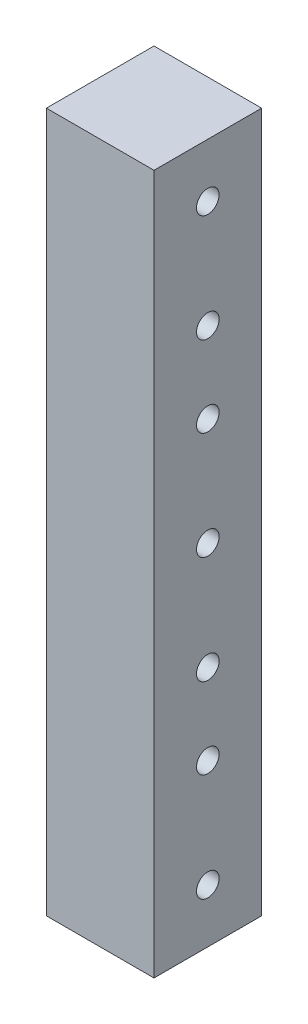
from build123d import *

# Parameters (mm, degrees)
SKETCH_1_W          = 20
SKETCH_1_H          = 20
EXTRUDE_1_DEPTH     = 130
SKETCH_2_R          = 2.1
CUT_EXTRUDE_1_DEPTH = 132.909059583


with BuildPart() as part:
    # 草图1 → 凸台-拉伸1 (new body)
    with BuildSketch(Plane(origin=(0, 0, 0), x_dir=(1, 0, 0), z_dir=(0, 1, 0))):
        Rectangle(SKETCH_1_W, SKETCH_1_H)
    extrude(amount=EXTRUDE_1_DEPTH)

    # 草图2 → 切除-拉伸1 (cut, through all)
    with BuildSketch(Plane(origin=(10, 0, 0), x_dir=(0, 0, -1), z_dir=(1, 0, 0))):
        with Locations((0, 45)):
            Circle(SKETCH_2_R)
        with Locations((0, 65)):
            Circle(SKETCH_2_R)
        with Locations((0, 85)):
            Circle(SKETCH_2_R)
        with Locations((0, 10)):
            Circle(SKETCH_2_R)
        with Locations((0, 30)):
            Circle(SKETCH_2_R)
        with Locations(Location((0, 100, 0), (0, 0, 180))):
            Circle(SKETCH_2_R)
        with Locations(Location((0, 120, 0), (0, 0, 180))):
            Circle(SKETCH_2_R)
    extrude(amount=-CUT_EXTRUDE_1_DEPTH, mode=Mode.SUBTRACT)


solid = part.part
